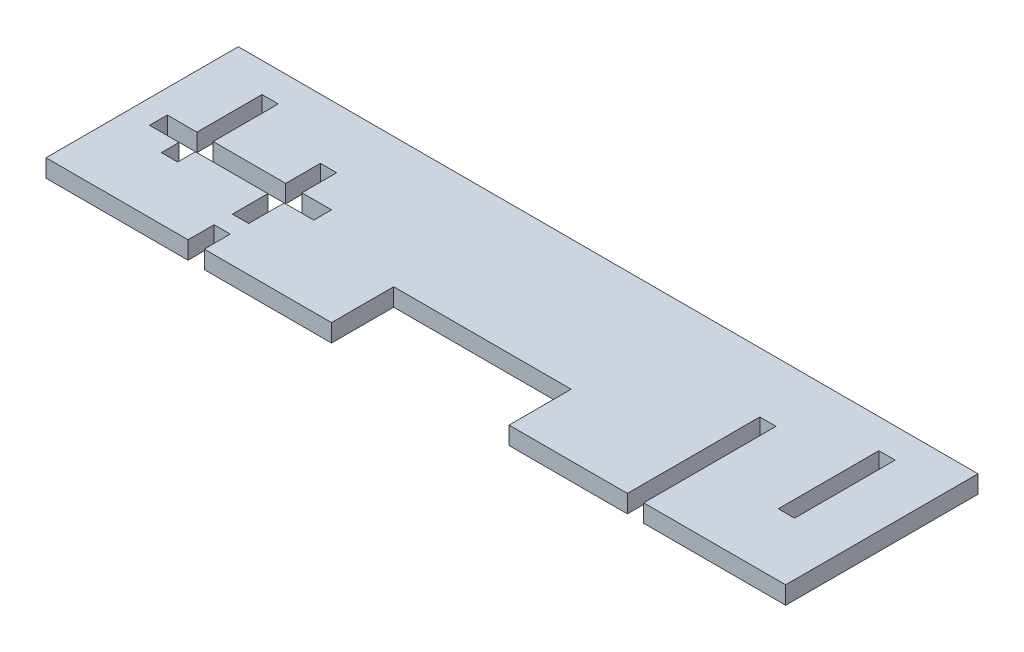
from build123d import *

# Parameters (mm, degrees)
SKETCH1_W           = 250
SKETCH1_H           = 65
BOSS_EXTRUDE1_DEPTH = 6
SKETCH2_W           = 5.5
SKETCH2_H           = 34
SKETCH2_H_2         = 47.5
CUT_EXTRUDE1_DEPTH  = 259.381500886
SKETCH3_W           = 60
SKETCH3_H           = 21
CUT_EXTRUDE2_DEPTH  = 259.381500886
SKETCH4_W           = 55.5
SKETCH4_H           = 6
CUT_EXTRUDE3_DEPTH  = 259.381500886
SKETCH5_W           = 5.5
SKETCH5_H           = 6.2
BOSS_EXTRUDE2_DEPTH = 6


with BuildPart() as part:
    # Sketch1 → Boss-Extrude1 (new body)
    with BuildSketch(Plane(origin=(0, 0, 0), x_dir=(1, 0, 0), z_dir=(0, 1, 0))):
        with Locations((125, 32.5)):
            Rectangle(SKETCH1_W, SKETCH1_H)
    extrude(amount=BOSS_EXTRUDE1_DEPTH)

    # Sketch2 → Cut-Extrude1 (cut, through all)
    with BuildSketch(Plane(origin=(0, 6, 0), x_dir=(1, 0, 0), z_dir=(0, 1, 0))):
        with Locations((20.75, 38)):
            Rectangle(SKETCH2_W, SKETCH2_H)
        with Locations((50.75, 21)):
            Rectangle(SKETCH2_W, SKETCH2_H_2)
        with Locations((199.25, 21)):
            Rectangle(SKETCH2_W, SKETCH2_H_2)
        with Locations((229.25, 38)):
            Rectangle(SKETCH2_W, SKETCH2_H)
    extrude(amount=-CUT_EXTRUDE1_DEPTH, mode=Mode.SUBTRACT)

    # Sketch3 → Cut-Extrude2 (cut, through all)
    with BuildSketch(Plane(origin=(0, 6, 0), x_dir=(1, 0, 0), z_dir=(0, 1, 0))):
        with Locations((126.5, 10.5)):
            Rectangle(SKETCH3_W, SKETCH3_H)
    extrude(amount=-CUT_EXTRUDE2_DEPTH, mode=Mode.SUBTRACT)

    # Sketch4 → Cut-Extrude3 (cut, through all)
    with BuildSketch(Plane(origin=(0, 6, 0), x_dir=(1, 0, 0), z_dir=(0, 1, 0))):
        with Locations((35.75, 30)):
            Rectangle(SKETCH4_W, SKETCH4_H)
    extrude(amount=-CUT_EXTRUDE3_DEPTH, mode=Mode.SUBTRACT)

    # Sketch5 → Boss-Extrude2 (add)
    with BuildSketch(Plane(origin=(0, 6, 0), x_dir=(1, 0, 0), z_dir=(0, 1, 0))):
        with Locations((50.75, 11.9)):
            Rectangle(SKETCH5_W, SKETCH5_H)
    extrude(amount=-BOSS_EXTRUDE2_DEPTH)


solid = part.part
